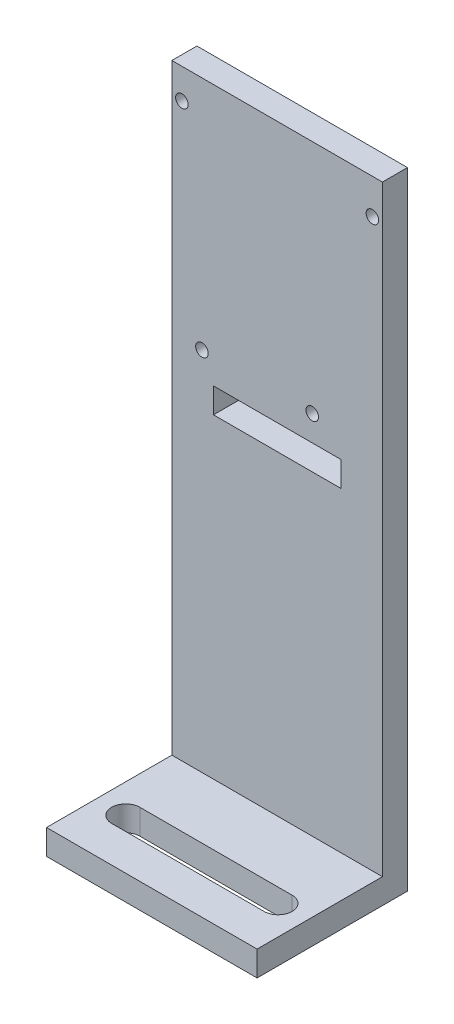
from build123d import *

# Parameters (mm, degrees)
SKETCH1_W           = 53.34
SKETCH1_H           = 158.75
SKETCH1_R           = 1.5875
BOSS_EXTRUDE1_DEPTH = 6.35
SKETCH2_3_W         = 32.258
SKETCH2_3_H         = 6.35
CUT_EXTRUDE2_DEPTH  = 137.662311459
SKETCH6_W           = 53.34
SKETCH6_H           = 6.35
BOSS_EXTRUDE5_DEPTH = 31.75
CUT_EXTRUDE3_REACH  = 165.072


with BuildPart() as part:
    # Sketch1 → Boss-Extrude1 (new body)
    with BuildSketch(Plane.XY):
        with Locations((-17.091445783, 49.935481928)):
            Rectangle(SKETCH1_W, SKETCH1_H)
        with Locations((-36.141445783, 69.620481928)):
            Circle(SKETCH1_R, mode=Mode.SUBTRACT)
        with Locations((-8.201445783, 69.620481928)):
            Circle(SKETCH1_R, mode=Mode.SUBTRACT)
        with Locations((-41.221445783, 121.690481928)):
            Circle(SKETCH1_R, mode=Mode.SUBTRACT)
        with Locations((7.038554217, 120.420481928)):
            Circle(SKETCH1_R, mode=Mode.SUBTRACT)
    extrude(amount=BOSS_EXTRUDE1_DEPTH)

    # Sketch2<3> → Cut-Extrude2 (cut, through all)
    with BuildSketch(Plane.XY.offset(6.35)):
        with Locations((-17.091445783, 60.014063864)):
            Rectangle(SKETCH2_3_W, SKETCH2_3_H)
    extrude(amount=-CUT_EXTRUDE2_DEPTH, mode=Mode.SUBTRACT)

    # Sketch6 → Boss-Extrude5 (add)
    with BuildSketch(Plane.XY.offset(6.35)):
        with Locations((-17.091445783, -26.264518072)):
            Rectangle(SKETCH6_W, SKETCH6_H)
    extrude(amount=BOSS_EXTRUDE5_DEPTH)

    # Sketch7 → Cut-Extrude3 (cut, up to next)
    with BuildSketch(Plane(origin=(0, -23.089518072, 0), x_dir=(1, 0, 0), z_dir=(0, 1, 0)), mode=Mode.PRIVATE) as cut_extrude3_sk1:
        with BuildLine():
            Line((-36.395445783, -21.844), (2.212554217, -21.844))
            ThreePointArc((2.212554217, -21.844), (5.768554217, -25.4), (2.212554217, -28.956))
            Line((2.212554217, -28.956), (-36.395445783, -28.956))
            ThreePointArc((-36.395445783, -28.956), (-39.951445783, -25.4), (-36.395445783, -21.844))
        make_face()
    cut_extrude3_tool1 = extrude(cut_extrude3_sk1.sketch, amount=-CUT_EXTRUDE3_REACH, mode=Mode.PRIVATE) & part.part
    add(cut_extrude3_tool1.solids().sort_by_distance((-17.091446, -23.089518, 25.4))[0], mode=Mode.SUBTRACT)


solid = part.part
